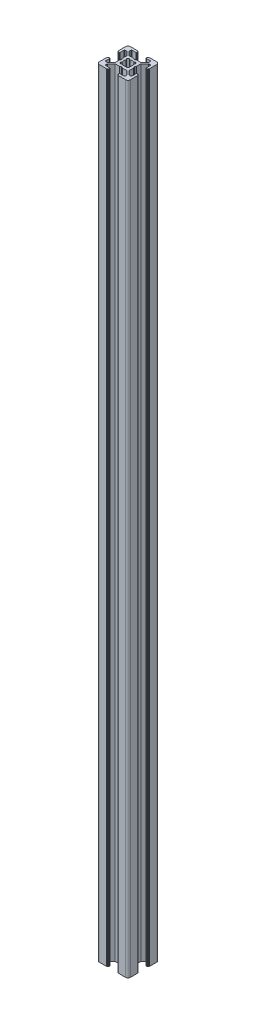
from build123d import *

# Parameters (mm, degrees)
BOSS_EXTRUDE1_DEPTH = 250


with BuildPart() as part:
    # Sketch2 → Boss-Extrude1 (new, symmetric)
    with BuildSketch(Plane(origin=(0, 0, 0), x_dir=(1, 0, 0), z_dir=(0, 1, 0))):
        with BuildLine():
            Line((-10, 3.75), (-10, 8.5))
            ThreePointArc((-10, 8.5), (-9.560660172, 9.560660172), (-8.5, 10))
            Line((-8.5, 10), (-3.75, 10))
            ThreePointArc((-3.75, 10), (-3.608578644, 9.941421356), (-3.55, 9.8))
            Line((-3.55, 9.8), (-3.55, 9.7))
            ThreePointArc((-3.55, 9.7), (-3.491421356, 9.558578644), (-3.35, 9.5))
            Line((-3.35, 9.5), (-3.2, 9.5))
            ThreePointArc((-3.2, 9.5), (-3.058578644, 9.441421356), (-3, 9.3))
            Line((-3, 9.3), (-3, 8.9))
            ThreePointArc((-3, 8.9), (-3.117157288, 8.617157288), (-3.4, 8.5))
            Line((-3.4, 8.5), (-5.9, 8.5))
            ThreePointArc((-5.9, 8.5), (-6.182842712, 8.382842712), (-6.3, 8.1))
            Line((-6.3, 8.1), (-6.3, 7.172792206))
            ThreePointArc((-6.3, 7.172792206), (-6.269551813, 7.019718833), (-6.182842712, 6.889949494))
            Line((-6.182842712, 6.889949494), (-3.910050506, 4.617157288))
            ThreePointArc((-3.910050506, 4.617157288), (-3.780281167, 4.530448187), (-3.627207794, 4.5))
            Line((-3.627207794, 4.5), (-0.919615242, 4.5))
            ThreePointArc((-0.919615242, 4.5), (-0.867851433, 4.493185165), (-0.819615242, 4.473205081))
            Line((-0.819615242, 4.473205081), (-0.1, 4.057735027))
            ThreePointArc((-0.1, 4.057735027), (0, 4.030940108), (0.1, 4.057735027))
            Line((0.1, 4.057735027), (0.819615242, 4.473205081))
            ThreePointArc((0.819615242, 4.473205081), (0.867851433, 4.493185165), (0.919615242, 4.5))
            Line((0.919615242, 4.5), (3.627207794, 4.5))
            ThreePointArc((3.627207794, 4.5), (3.780281167, 4.530448187), (3.910050506, 4.617157288))
            Line((3.910050506, 4.617157288), (6.182842712, 6.889949494))
            ThreePointArc((6.182842712, 6.889949494), (6.269551813, 7.019718833), (6.3, 7.172792206))
            Line((6.3, 7.172792206), (6.3, 8.1))
            ThreePointArc((6.3, 8.1), (6.182842712, 8.382842712), (5.9, 8.5))
            Line((5.9, 8.5), (3.4, 8.5))
            ThreePointArc((3.4, 8.5), (3.117157288, 8.617157288), (3, 8.9))
            Line((3, 8.9), (3, 9.3))
            ThreePointArc((3, 9.3), (3.058578644, 9.441421356), (3.2, 9.5))
            Line((3.2, 9.5), (3.35, 9.5))
            ThreePointArc((3.35, 9.5), (3.491421356, 9.558578644), (3.55, 9.7))
            Line((3.55, 9.7), (3.55, 9.8))
            ThreePointArc((3.55, 9.8), (3.608578644, 9.941421356), (3.75, 10))
            Line((3.75, 10), (8.5, 10))
            ThreePointArc((8.5, 10), (9.560660172, 9.560660172), (10, 8.5))
            Line((10, 8.5), (10, 3.75))
            ThreePointArc((10, 3.75), (9.941421356, 3.608578644), (9.8, 3.55))
            Line((9.8, 3.55), (9.7, 3.55))
            ThreePointArc((9.7, 3.55), (9.558578644, 3.491421356), (9.5, 3.35))
            Line((9.5, 3.35), (9.5, 3.2))
            ThreePointArc((9.5, 3.2), (9.441421356, 3.058578644), (9.3, 3))
            Line((9.3, 3), (8.9, 3))
            ThreePointArc((8.9, 3), (8.617157288, 3.117157288), (8.5, 3.4))
            Line((8.5, 3.4), (8.5, 5.9))
            ThreePointArc((8.5, 5.9), (8.382842712, 6.182842712), (8.1, 6.3))
            Line((8.1, 6.3), (7.172792206, 6.3))
            ThreePointArc((7.172792206, 6.3), (7.019718833, 6.269551813), (6.889949494, 6.182842712))
            Line((6.889949494, 6.182842712), (4.617157288, 3.910050506))
            ThreePointArc((4.617157288, 3.910050506), (4.530448187, 3.780281167), (4.5, 3.627207794))
            Line((4.5, 3.627207794), (4.5, 0.919615242))
            ThreePointArc((4.5, 0.919615242), (4.493185165, 0.867851433), (4.473205081, 0.819615242))
            Line((4.473205081, 0.819615242), (4.057735027, 0.1))
            ThreePointArc((4.057735027, 0.1), (4.030940108, 0), (4.057735027, -0.1))
            Line((4.057735027, -0.1), (4.473205081, -0.819615242))
            ThreePointArc((4.473205081, -0.819615242), (4.493185165, -0.867851433), (4.5, -0.919615242))
            Line((4.5, -0.919615242), (4.5, -3.627207794))
            ThreePointArc((4.5, -3.627207794), (4.530448187, -3.780281167), (4.617157288, -3.910050506))
            Line((4.617157288, -3.910050506), (6.889949494, -6.182842712))
            ThreePointArc((6.889949494, -6.182842712), (7.019718833, -6.269551813), (7.172792206, -6.3))
            Line((7.172792206, -6.3), (8.1, -6.3))
            ThreePointArc((8.1, -6.3), (8.382842712, -6.182842712), (8.5, -5.9))
            Line((8.5, -5.9), (8.5, -3.4))
            ThreePointArc((8.5, -3.4), (8.617157288, -3.117157288), (8.9, -3))
            Line((8.9, -3), (9.3, -3))
            ThreePointArc((9.3, -3), (9.441421356, -3.058578644), (9.5, -3.2))
            Line((9.5, -3.2), (9.5, -3.35))
            ThreePointArc((9.5, -3.35), (9.558578644, -3.491421356), (9.7, -3.55))
            Line((9.7, -3.55), (9.8, -3.55))
            ThreePointArc((9.8, -3.55), (9.941421356, -3.608578644), (10, -3.75))
            Line((10, -3.75), (10, -8.5))
            ThreePointArc((10, -8.5), (9.560660172, -9.560660172), (8.5, -10))
            Line((8.5, -10), (3.75, -10))
            ThreePointArc((3.75, -10), (3.608578644, -9.941421356), (3.55, -9.8))
            Line((3.55, -9.8), (3.55, -9.7))
            ThreePointArc((3.55, -9.7), (3.491421356, -9.558578644), (3.35, -9.5))
            Line((3.35, -9.5), (3.2, -9.5))
            ThreePointArc((3.2, -9.5), (3.058578644, -9.441421356), (3, -9.3))
            Line((3, -9.3), (3, -8.9))
            ThreePointArc((3, -8.9), (3.117157288, -8.617157288), (3.4, -8.5))
            Line((3.4, -8.5), (5.9, -8.5))
            ThreePointArc((5.9, -8.5), (6.182842712, -8.382842712), (6.3, -8.1))
            Line((6.3, -8.1), (6.3, -7.172792206))
            ThreePointArc((6.3, -7.172792206), (6.269551813, -7.019718833), (6.182842712, -6.889949494))
            Line((6.182842712, -6.889949494), (3.910050506, -4.617157288))
            ThreePointArc((3.910050506, -4.617157288), (3.780281167, -4.530448187), (3.627207794, -4.5))
            Line((3.627207794, -4.5), (0.919615242, -4.5))
            ThreePointArc((0.919615242, -4.5), (0.867851433, -4.493185165), (0.819615242, -4.473205081))
            Line((0.819615242, -4.473205081), (0.1, -4.057735027))
            ThreePointArc((0.1, -4.057735027), (0, -4.030940108), (-0.1, -4.057735027))
            Line((-0.1, -4.057735027), (-0.819615242, -4.473205081))
            ThreePointArc((-0.819615242, -4.473205081), (-0.867851433, -4.493185165), (-0.919615242, -4.5))
            Line((-0.919615242, -4.5), (-3.627207794, -4.5))
            ThreePointArc((-3.627207794, -4.5), (-3.780281167, -4.530448187), (-3.910050506, -4.617157288))
            Line((-3.910050506, -4.617157288), (-6.182842712, -6.889949494))
            ThreePointArc((-6.182842712, -6.889949494), (-6.269551813, -7.019718833), (-6.3, -7.172792206))
            Line((-6.3, -7.172792206), (-6.3, -8.1))
            ThreePointArc((-6.3, -8.1), (-6.182842712, -8.382842712), (-5.9, -8.5))
            Line((-5.9, -8.5), (-3.4, -8.5))
            ThreePointArc((-3.4, -8.5), (-3.117157288, -8.617157288), (-3, -8.9))
            Line((-3, -8.9), (-3, -9.3))
            ThreePointArc((-3, -9.3), (-3.058578644, -9.441421356), (-3.2, -9.5))
            Line((-3.2, -9.5), (-3.35, -9.5))
            ThreePointArc((-3.35, -9.5), (-3.491421356, -9.558578644), (-3.55, -9.7))
            Line((-3.55, -9.7), (-3.55, -9.8))
            ThreePointArc((-3.55, -9.8), (-3.608578644, -9.941421356), (-3.75, -10))
            Line((-3.75, -10), (-8.5, -10))
            ThreePointArc((-8.5, -10), (-9.560660172, -9.560660172), (-10, -8.5))
            Line((-10, -8.5), (-10, -3.75))
            ThreePointArc((-10, -3.75), (-9.941421356, -3.608578644), (-9.8, -3.55))
            Line((-9.8, -3.55), (-9.7, -3.55))
            ThreePointArc((-9.7, -3.55), (-9.558578644, -3.491421356), (-9.5, -3.35))
            Line((-9.5, -3.35), (-9.5, -3.2))
            ThreePointArc((-9.5, -3.2), (-9.441421356, -3.058578644), (-9.3, -3))
            Line((-9.3, -3), (-8.9, -3))
            ThreePointArc((-8.9, -3), (-8.617157288, -3.117157288), (-8.5, -3.4))
            Line((-8.5, -3.4), (-8.5, -5.9))
            ThreePointArc((-8.5, -5.9), (-8.382842712, -6.182842712), (-8.1, -6.3))
            Line((-8.1, -6.3), (-7.172792206, -6.3))
            ThreePointArc((-7.172792206, -6.3), (-7.019718833, -6.269551813), (-6.889949494, -6.182842712))
            Line((-6.889949494, -6.182842712), (-4.617157288, -3.910050506))
            ThreePointArc((-4.617157288, -3.910050506), (-4.530448187, -3.780281167), (-4.5, -3.627207794))
            Line((-4.5, -3.627207794), (-4.5, -0.919615242))
            ThreePointArc((-4.5, -0.919615242), (-4.493185165, -0.867851433), (-4.473205081, -0.819615242))
            Line((-4.473205081, -0.819615242), (-4.057735027, -0.1))
            ThreePointArc((-4.057735027, -0.1), (-4.030940108, 0), (-4.057735027, 0.1))
            Line((-4.057735027, 0.1), (-4.473205081, 0.819615242))
            ThreePointArc((-4.473205081, 0.819615242), (-4.493185165, 0.867851433), (-4.5, 0.919615242))
            Line((-4.5, 0.919615242), (-4.5, 3.627207794))
            ThreePointArc((-4.5, 3.627207794), (-4.530448187, 3.780281167), (-4.617157288, 3.910050506))
            Line((-4.617157288, 3.910050506), (-6.889949494, 6.182842712))
            ThreePointArc((-6.889949494, 6.182842712), (-7.019718833, 6.269551813), (-7.172792206, 6.3))
            Line((-7.172792206, 6.3), (-8.1, 6.3))
            ThreePointArc((-8.1, 6.3), (-8.382842712, 6.182842712), (-8.5, 5.9))
            Line((-8.5, 5.9), (-8.5, 3.4))
            ThreePointArc((-8.5, 3.4), (-8.617157288, 3.117157288), (-8.9, 3))
            Line((-8.9, 3), (-9.3, 3))
            ThreePointArc((-9.3, 3), (-9.441421356, 3.058578644), (-9.5, 3.2))
            Line((-9.5, 3.2), (-9.5, 3.35))
            ThreePointArc((-9.5, 3.35), (-9.558578644, 3.491421356), (-9.7, 3.55))
            Line((-9.7, 3.55), (-9.8, 3.55))
            ThreePointArc((-9.8, 3.55), (-9.941421356, 3.608578644), (-10, 3.75))
        make_face()
        with BuildLine():
            Line((-2.479688955, 1.419028783), (-2.896761999, 1.836101827))
            ThreePointArc((-2.896761999, 1.836101827), (-2.940106295, 1.928880314), (-2.913814922, 2.02785172))
            ThreePointArc((-2.913814922, 2.02785172), (-2.510229073, 2.510229073), (-2.02785172, 2.913814922))
            ThreePointArc((-2.02785172, 2.913814922), (-1.928880314, 2.940106295), (-1.836101827, 2.896761999))
            Line((-1.836101827, 2.896761999), (-1.419028783, 2.479688955))
            ThreePointArc((-1.419028783, 2.479688955), (-1.336531377, 2.437618141), (-1.245050899, 2.452009025))
            ThreePointArc((-1.245050899, 2.452009025), (0, 2.75), (1.245050899, 2.452009025))
            ThreePointArc((1.245050899, 2.452009025), (1.336531377, 2.437618141), (1.419028783, 2.479688955))
            Line((1.419028783, 2.479688955), (1.836101827, 2.896761999))
            ThreePointArc((1.836101827, 2.896761999), (1.928880314, 2.940106295), (2.02785172, 2.913814922))
            ThreePointArc((2.02785172, 2.913814922), (2.510229073, 2.510229073), (2.913814922, 2.02785172))
            ThreePointArc((2.913814922, 2.02785172), (2.940106295, 1.928880314), (2.896761999, 1.836101827))
            Line((2.896761999, 1.836101827), (2.479688955, 1.419028783))
            ThreePointArc((2.479688955, 1.419028783), (2.437618141, 1.336531377), (2.452009025, 1.245050899))
            ThreePointArc((2.452009025, 1.245050899), (2.75, 0), (2.452009025, -1.245050899))
            ThreePointArc((2.452009025, -1.245050899), (2.437618141, -1.336531377), (2.479688955, -1.419028783))
            Line((2.479688955, -1.419028783), (2.896761999, -1.836101827))
            ThreePointArc((2.896761999, -1.836101827), (2.940106295, -1.928880314), (2.913814922, -2.02785172))
            ThreePointArc((2.913814922, -2.02785172), (2.510229073, -2.510229073), (2.02785172, -2.913814922))
            ThreePointArc((2.02785172, -2.913814922), (1.928880314, -2.940106295), (1.836101827, -2.896761999))
            Line((1.836101827, -2.896761999), (1.419028783, -2.479688955))
            ThreePointArc((1.419028783, -2.479688955), (1.336531377, -2.437618141), (1.245050899, -2.452009025))
            ThreePointArc((1.245050899, -2.452009025), (0, -2.75), (-1.245050899, -2.452009025))
            ThreePointArc((-1.245050899, -2.452009025), (-1.336531377, -2.437618141), (-1.419028783, -2.479688955))
            Line((-1.419028783, -2.479688955), (-1.836101827, -2.896761999))
            ThreePointArc((-1.836101827, -2.896761999), (-1.928880314, -2.940106295), (-2.02785172, -2.913814922))
            ThreePointArc((-2.02785172, -2.913814922), (-2.510229073, -2.510229073), (-2.913814922, -2.02785172))
            ThreePointArc((-2.913814922, -2.02785172), (-2.940106295, -1.928880314), (-2.896761999, -1.836101827))
            Line((-2.896761999, -1.836101827), (-2.479688955, -1.419028783))
            ThreePointArc((-2.479688955, -1.419028783), (-2.437618141, -1.336531377), (-2.452009025, -1.245050899))
            ThreePointArc((-2.452009025, -1.245050899), (-2.75, 0), (-2.452009025, 1.245050899))
            ThreePointArc((-2.452009025, 1.245050899), (-2.437618141, 1.336531377), (-2.479688955, 1.419028783))
        make_face(mode=Mode.SUBTRACT)
    extrude(amount=BOSS_EXTRUDE1_DEPTH, both=True)


solid = part.part
